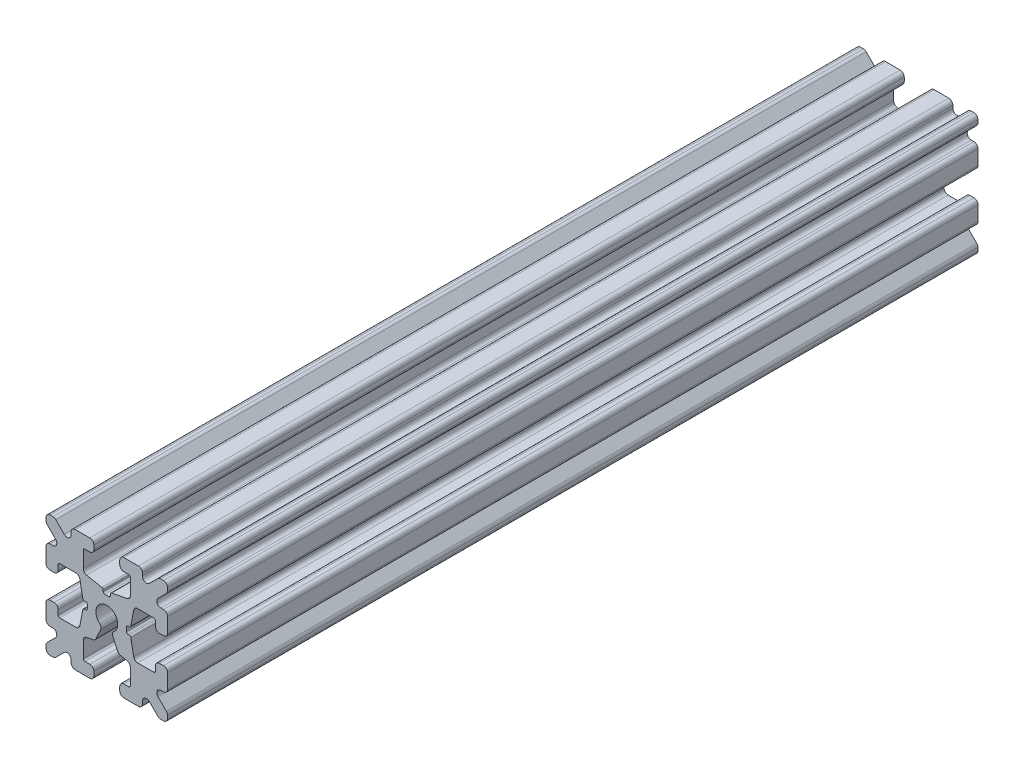
from build123d import *

# Parameters (mm, degrees)
SKETCH1_W           = 15
SKETCH1_H           = 15
SKETCH1_R           = 1.35
BOSS_EXTRUDE1_DEPTH = 50
FILLET1_R           = 0.5
CUT_EXTRUDE1_DEPTH  = 101.560926806
CUT_EXTRUDE3_DEPTH  = 101.560926806
FILLET3_R           = 0.5
FILLET4_R           = 0.5
FILLET5_R           = 3
FILLET6_R           = 0.2
CUT_EXTRUDE4_DEPTH  = 101.560926806
FILLET8_R           = 0.5
SKETCH6_W           = 6.249171159
SKETCH6_H           = 0.889
SKETCH6_W_2         = 0.889
SKETCH6_H_2         = 6.249171159
CUT_EXTRUDE5_DEPTH  = 101.560926806
CUT_EXTRUDE6_DEPTH  = 101.560926806
FILLET9_R           = 0.5
FILLET10_R          = 0.2


with BuildPart() as part:
    # Sketch1 → Boss-Extrude1 (new, symmetric)
    with BuildSketch(Plane.XY):
        Rectangle(SKETCH1_W, SKETCH1_H)
        Circle(SKETCH1_R, mode=Mode.SUBTRACT)
    extrude(amount=BOSS_EXTRUDE1_DEPTH, both=True)

    # Fillet1
    fillet1_edges = [part.edges().sort_by_distance(p)[0] for p in [
        (7.5, -7.5, 0),
        (-7.5, -7.5, 0),
        (-7.5, 7.5, 0),
        (7.5, 7.5, 0),
    ]]
    fillet(fillet1_edges, radius=FILLET1_R)

    # Sketch2 → Cut-Extrude1 (cut, through all)
    with BuildSketch(Plane.XY.offset(50)):
        Polygon((-7.5, 1.6), (-6, 1.6), (-6, 2.9), (-3.4, 2.9), (-3.4, -2.9), (-6, -2.9), (-6, -1.6), (-7.5, -1.6), align=None)
        Polygon((2.9, 6), (1.6, 6), (1.6, 7.5), (-1.6, 7.5), (-1.6, 6), (-2.9, 6), (-2.9, 3.4), (2.9, 3.4), align=None)
        Polygon((-1.6, -7.5), (-1.6, -6), (-2.9, -6), (-2.9, -3.4), (2.9, -3.4), (2.9, -6), (1.6, -6), (1.6, -7.5), align=None)
        Polygon((6, -2.9), (6, -1.6), (7.5, -1.6), (7.5, 1.6), (6, 1.6), (6, 2.9), (3.4, 2.9), (3.4, -2.9), align=None)
    extrude(amount=-CUT_EXTRUDE1_DEPTH, mode=Mode.SUBTRACT)

    # Sketch4 → Cut-Extrude3 (cut, through all)
    with BuildSketch(Plane.XY.offset(50)):
        Polygon((-3.4, 2.9), (-2.85, 0), (-3.4, -2.9), align=None)
        Polygon((-2.9, 3.4), (0, 2.85), (2.9, 3.4), align=None)
        Polygon((3.4, 2.9), (2.85, 0), (3.4, -2.9), align=None)
        Polygon((-2.9, -3.4), (0, -2.85), (2.9, -3.4), align=None)
    extrude(amount=-CUT_EXTRUDE3_DEPTH, mode=Mode.SUBTRACT)

    # Fillet3
    fillet3_edges = [part.edges().sort_by_distance(p)[0] for p in [
        (1.6, -7.5, 0),
        (-1.6, -7.5, 0),
        (-1.6, -6, 0),
        (1.6, -6, 0),
        (6, 1.6, 0),
        (7.5, 1.6, 0),
        (7.5, -1.6, 0),
        (6, -1.6, 0),
        (-7.5, -1.6, 0),
        (-7.5, 1.6, 0),
        (-6, 1.6, 0),
        (-6, -1.6, 0),
        (-1.6, 6, 0),
        (-1.6, 7.5, 0),
        (1.6, 7.5, 0),
        (1.6, 6, 0),
    ]]
    fillet(fillet3_edges, radius=FILLET3_R)

    # Fillet4
    fillet4_edges = [part.edges().sort_by_distance(p)[0] for p in [
        (-2.9, -3.4, 0),
        (2.9, -3.4, 0),
        (3.4, -2.9, 0),
        (3.4, 2.9, 0),
        (-3.4, 2.9, 0),
        (-3.4, -2.9, 0),
        (2.9, 3.4, 0),
        (-2.9, 3.4, 0),
    ]]
    fillet(fillet4_edges, radius=FILLET4_R)

    # Fillet5
    fillet5_edges = [part.edges().sort_by_distance(p)[0] for p in [
        (-2.85, 0, 0),
        (0, 2.85, 0),
        (2.85, 0, 0),
        (0, -2.85, 0),
    ]]
    fillet(fillet5_edges, radius=FILLET5_R)

    # Fillet6
    fillet6_edges = [part.edges().sort_by_distance(p)[0] for p in [
        (-2.9, -6, 0),
        (2.9, -6, 0),
        (6, -2.9, 0),
        (6, 2.9, 0),
        (-6, 2.9, 0),
        (-6, -2.9, 0),
        (2.9, 6, 0),
        (-2.9, 6, 0),
    ]]
    fillet(fillet6_edges, radius=FILLET6_R)

    # Sketch5 → Cut-Extrude4 (cut, through all)
    with BuildSketch(Plane.XY.offset(50)):
        Polygon((-7.5, 6.439339828), (-5.460660172, 4.4), (-7.5, 4.4), align=None)
        Polygon((-6.439339828, 7.5), (-4.4, 5.460660172), (-4.4, 7.5), align=None)
        Polygon((4.4, 7.5), (6.439339828, 7.5), (4.4, 5.460660172), align=None)
        Polygon((7.5, 6.439339828), (7.5, 4.4), (5.460660172, 4.4), align=None)
        Polygon((7.5, -6.439339828), (5.460660172, -4.4), (7.5, -4.4), align=None)
        Polygon((6.439339828, -7.5), (4.4, -5.460660172), (4.4, -7.5), align=None)
        Polygon((-4.4, -7.5), (-6.439339828, -7.5), (-4.4, -5.460660172), align=None)
        Polygon((-7.5, -6.439339828), (-7.5, -4.4), (-5.460660172, -4.4), align=None)
    extrude(amount=-CUT_EXTRUDE4_DEPTH, mode=Mode.SUBTRACT)

    # Fillet8
    fillet8_edges = [part.edges().sort_by_distance(p)[0] for p in [
        (-7.5, 4.4, 0),
        (-7.5, 6.439339828, 0),
        (-5.460660172, 4.4, 0),
        (7.5, -4.4, 0),
        (7.5, -6.439339828, 0),
        (5.460660172, -4.4, 0),
        (5.460660172, 4.4, 0),
        (7.5, 6.439339828, 0),
        (7.5, 4.4, 0),
        (-4.4, 7.5, 0),
        (-4.4, 5.460660172, 0),
        (-6.439339828, 7.5, 0),
        (-5.460660172, -4.4, 0),
        (-7.5, -6.439339828, 0),
        (-7.5, -4.4, 0),
        (4.4, 5.460660172, 0),
        (4.4, 7.5, 0),
        (6.439339828, 7.5, 0),
        (6.439339828, -7.5, 0),
        (4.4, -7.5, 0),
        (4.4, -5.460660172, 0),
        (-6.439339828, -7.5, 0),
        (-4.4, -5.460660172, 0),
        (-4.4, -7.5, 0),
    ]]
    fillet(fillet8_edges, radius=FILLET8_R)

    # Sketch6 → Cut-Extrude5 (cut, through all)
    with BuildSketch(Plane.XY.offset(50)):
        with Locations((5.530603002, 0)):
            Rectangle(SKETCH6_W, SKETCH6_H)
        with Locations((-5.530603002, 0)):
            Rectangle(SKETCH6_W, SKETCH6_H)
        with Locations((0, 5.530603002)):
            Rectangle(SKETCH6_W_2, SKETCH6_H_2)
    extrude(amount=-CUT_EXTRUDE5_DEPTH, mode=Mode.SUBTRACT)

    # Sketch7 → Cut-Extrude6 (cut, through all)
    with BuildSketch(Plane.XY.offset(50)):
        Polygon((0, 0), (-2.153335353, -4.617842566), (2.153335353, -4.617842566), align=None)
    extrude(amount=-CUT_EXTRUDE6_DEPTH, mode=Mode.SUBTRACT)

    # Fillet9
    fillet9_edges = [part.edges().sort_by_distance(p)[0] for p in [
        (1.457911068, -3.126500375, 0),
        (-1.457911068, -3.126500375, 0),
        (-0.570534653, -1.223515512, 0),
        (0.570534653, -1.223515512, 0),
    ]]
    fillet(fillet9_edges, radius=FILLET9_R)

    # Fillet10
    fillet10_edges = [part.edges().sort_by_distance(p)[0] for p in [
        (-2.406017422, 0.4445, 0),
        (-2.406017422, -0.4445, 0),
        (0.4445, 2.406017422, 0),
        (-0.4445, 2.406017422, 0),
        (2.406017422, 0.4445, 0),
        (2.406017422, -0.4445, 0),
        (-2.93658978, -0.4445, 0),
        (-2.93658978, 0.4445, 0),
        (2.93658978, -0.4445, 0),
        (2.93658978, 0.4445, 0),
        (0.4445, 2.93658978, 0),
        (-0.4445, 2.93658978, 0),
    ]]
    fillet(fillet10_edges, radius=FILLET10_R)


solid = part.part
